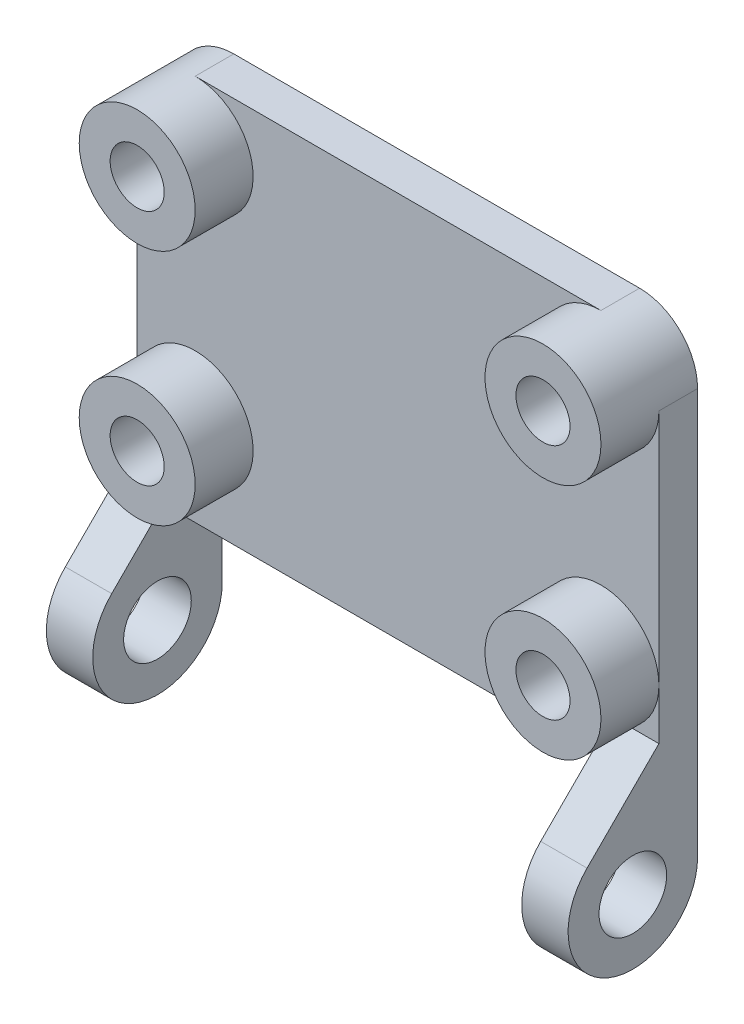
from build123d import *

# Parameters (mm, degrees)
SCHIZZO1_W                   = 27
SCHIZZO1_H                   = 20
SCHIZZO1_R                   = 1.4
ESTRUSIONE_ESTRUSIONE1_DEPTH = 2
RACCORDO1_R                  = 3
SCHIZZO2_R                   = 1.75
ESTRUSIONE_ESTRUSIONE2_DEPTH = 2.4
SCHIZZO3_R                   = 3
SCHIZZO3_R_2                 = 1.4
ESTRUSIONE_ESTRUSIONE3_DEPTH = 3


with BuildPart() as part:
    # Schizzo1 → Estrusione-Estrusione1 (new body)
    with BuildSketch(Plane.XY):
        Rectangle(SCHIZZO1_W, SCHIZZO1_H)
        with Locations((-10.5, 7)):
            Circle(SCHIZZO1_R, mode=Mode.SUBTRACT)
        with Locations((-10.5, -5.3)):
            Circle(SCHIZZO1_R, mode=Mode.SUBTRACT)
        with Locations((10.5, -5.3)):
            Circle(SCHIZZO1_R, mode=Mode.SUBTRACT)
        with Locations((10.5, 7)):
            Circle(SCHIZZO1_R, mode=Mode.SUBTRACT)
    extrude(amount=ESTRUSIONE_ESTRUSIONE1_DEPTH)

    # Raccordo1
    raccordo1_edges = [part.edges().sort_by_distance(p)[0] for p in [
        (-13.5, 10, 1),
        (13.5, 10, 1),
    ]]
    fillet(raccordo1_edges, radius=RACCORDO1_R)

    # Schizzo2 → Estrusione-Estrusione2 (add)
    with BuildSketch(Plane(origin=(13.5, 0, 0), x_dir=(0, 0, -1), z_dir=(1, 0, 0))):
        with BuildLine():
            Line((0, -10), (0, -14))
            ThreePointArc((0, -14), (-4.631989498, -17.094996434), (-5.718807717, -11.631192283))
            Line((-5.718807717, -11.631192283), (-2, -7.912384566))
            Line((-2, -7.912384566), (-2, -10))
            Line((-2, -10), (0, -10))
        make_face()
        with Locations((-3.35, -14)):
            Circle(SCHIZZO2_R, mode=Mode.SUBTRACT)
    estrusione_estrusione2 = extrude(amount=-ESTRUSIONE_ESTRUSIONE2_DEPTH)

    # Specchia1: Estrusione-Estrusione2 across plane
    add(estrusione_estrusione2.mirror(Plane(origin=(0, 0, 0), x_dir=(0, 0, 1), z_dir=(1, 0, 0))))

    # Schizzo3 → Estrusione-Estrusione3 (add)
    # profile 1 of 4: a face of its own
    with BuildSketch(Plane.XY.offset(2)):
        with Locations(Location((-10.5, 7, 0), (0, 0, 180))):
            Circle(SCHIZZO3_R)
        with Locations((-10.5, 7)):
            Circle(SCHIZZO3_R_2, mode=Mode.SUBTRACT)
    # profile 2 of 4: a face of its own
    with BuildSketch(Plane.XY.offset(2)):
        with Locations(Location((-10.5, -5.3, 0), (0, 0, 180))):
            Circle(SCHIZZO3_R)
        with Locations((-10.5, -5.3)):
            Circle(SCHIZZO3_R_2, mode=Mode.SUBTRACT)
    # profile 3 of 4: a face of its own
    with BuildSketch(Plane.XY.offset(2)):
        with Locations((10.5, -5.3)):
            Circle(SCHIZZO3_R)
        with Locations((10.5, -5.3)):
            Circle(SCHIZZO3_R_2, mode=Mode.SUBTRACT)
    # profile 4 of 4: a face of its own
    with BuildSketch(Plane.XY.offset(2)):
        with Locations((10.5, 7)):
            Circle(SCHIZZO3_R)
        with Locations((10.5, 7)):
            Circle(SCHIZZO3_R_2, mode=Mode.SUBTRACT)
    extrude(amount=ESTRUSIONE_ESTRUSIONE3_DEPTH)


solid = part.part
